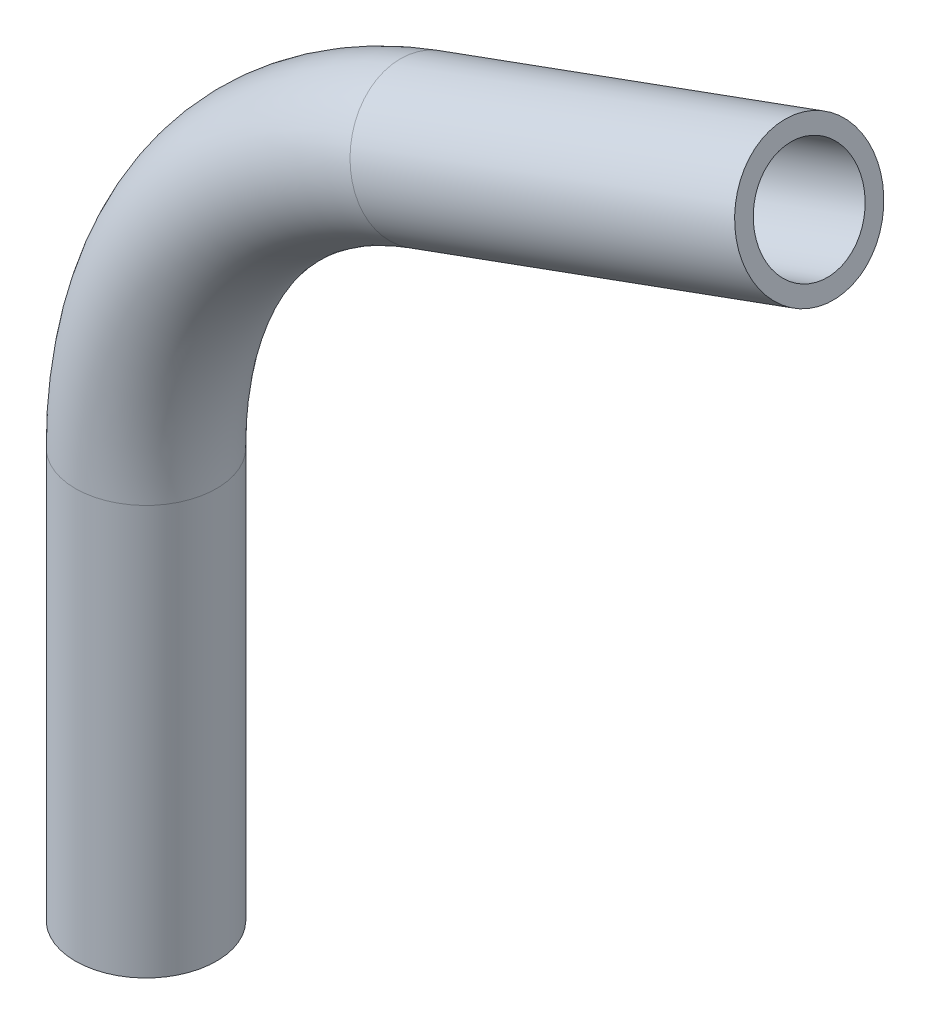
from build123d import *

# Parameters (mm, degrees)
SKETCH2_R   = 4
SKETCH2_R_2 = 3


with BuildPart() as part:
    # Sweep1: sweep along a path in Sketch1
    with BuildLine(Plane.XY) as sweep1_path:
        Line((0, 0), (0, 23.195019083))
        ThreePointArc((0, 23.195019083), (4.340350937, 36.960853555), (15.79151656, 45.747641982))
        Line((15.79151656, 45.747641982), (37.587704831, 53.680805733))
    # Sketch2 → Sweep1 (sweep)
    with BuildSketch(Plane(origin=(0, 0, 0), x_dir=(1, 0, 0), z_dir=(0, 1, 0))):
        Circle(SKETCH2_R)
        Circle(SKETCH2_R_2, mode=Mode.SUBTRACT)
    sweep(path=sweep1_path.line)


solid = part.part
